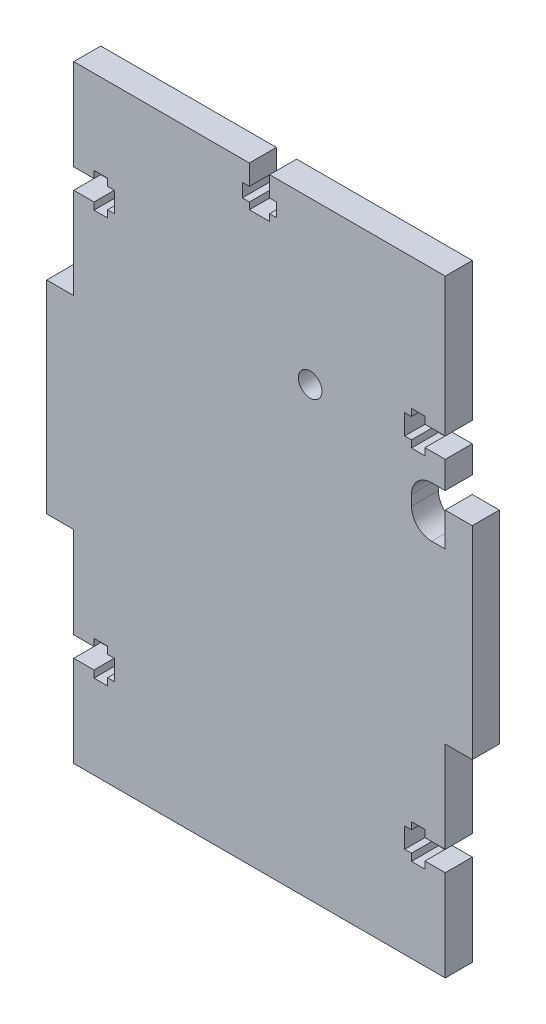
from build123d import *

# Parameters (mm, degrees)
SKETCH_1_R      = 1.75
EXTRUDE_1_DEPTH = 4
FILLET_1_R      = 3


with BuildPart() as part:
    # Эскиз1 → Бобышка-Вытянуть1 (new body)
    with BuildSketch(Plane.XY):
        Polygon((-27.5, -31.5), (-27.5, -45), (27.5, -45), (27.5, -31.5), (24.5, -31.5), (24.5, -32.55), (22.5, -32.55), (22.5, -31.5), (21.5, -31.5), (21.5, -28.5), (22.5, -28.5), (22.5, -27.45), (24.5, -27.45), (24.5, -28.5), (27.5, -28.5), (27.5, -15), (31.5, -15), (31.5, 15), (27.5, 15), (27.5, 10), (22.5, 10), (22.5, 17.5), (27.5, 17.5), (27.5, 21.5), (24.5, 21.5), (24.5, 20.45), (22.5, 20.45), (22.5, 21.5), (21.5, 21.5), (21.5, 24.5), (22.5, 24.5), (22.5, 25.55), (24.5, 25.55), (24.5, 24.5), (27.5, 24.5), (27.5, 45), (1.5, 45), (1.5, 42), (2.55, 42), (2.55, 40), (1.5, 40), (1.5, 39), (-1.5, 39), (-1.5, 40), (-2.55, 40), (-2.55, 42), (-1.5, 42), (-1.5, 45), (-27.5, 45), (-27.5, 31.5), (-24.5, 31.5), (-24.5, 32.55), (-22.5, 32.55), (-22.5, 31.5), (-21.5, 31.5), (-21.5, 28.5), (-22.5, 28.5), (-22.5, 27.45), (-24.5, 27.45), (-24.5, 28.5), (-27.5, 28.5), (-27.5, 15), (-31.5, 15), (-31.5, -15), (-27.5, -15), (-27.5, -28.5), (-24.5, -28.5), (-24.5, -27.45), (-22.5, -27.45), (-22.5, -28.5), (-21.5, -28.5), (-21.5, -31.5), (-22.5, -31.5), (-22.5, -32.55), (-24.5, -32.55), (-24.5, -31.5), align=None)
        with Locations((7.5, 21.1)):
            Circle(SKETCH_1_R, mode=Mode.SUBTRACT)
    extrude(amount=EXTRUDE_1_DEPTH)

    # Скругление1
    fillet_1_edges = [part.edges().sort_by_distance(p)[0] for p in [
        (22.5, 17.5, 2),
        (22.5, 10, 2),
    ]]
    fillet(fillet_1_edges, radius=FILLET_1_R)


solid = part.part
